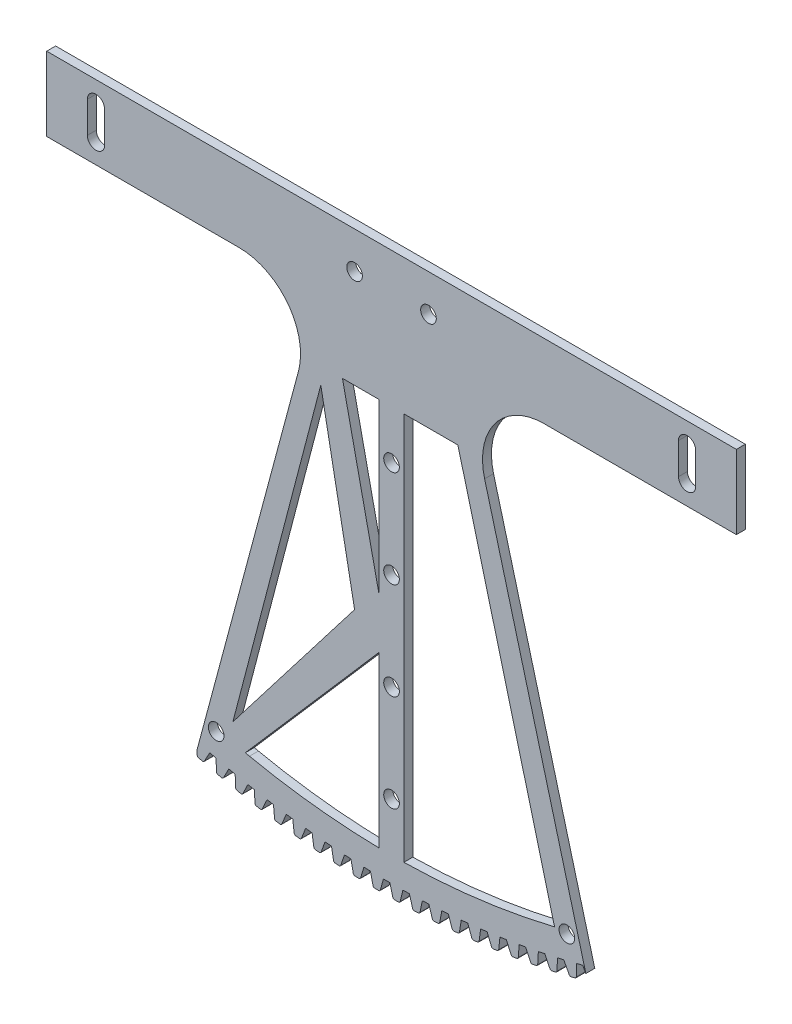
from build123d import *

# Parameters (mm, degrees)
BOSS_EXTRUDE2_DEPTH      = 3.628571429
FILLET1_R                = 25
BOSS_EXTRUDE4_DEPTH      = 3.628571429
CUT_EXTRUDE2_DEPTH       = 336.434355024
FILLET2_R                = 0.7
CIRPATTERN8_COUNT        = 20
CIRPATTERN8_ANGLE        = 28.5
FILLET2_OF_CIRPATTERN8_R = 0.7
SKETCH5_R                = 3.175
CUT_EXTRUDE3_DEPTH       = 338.740173511
SKETCH17_R               = 3.175
CUT_EXTRUDE4_DEPTH       = 338.740173511


with BuildPart() as part:
    # Sketch3 → Boss-Extrude2 (new body)
    with BuildSketch(Plane.XY):
        with BuildLine():
            Line((-140, -79.56), (-140, -109.56))
            Line((-140, -109.56), (-29.356513523, -109.56))
            Line((-29.356513523, -109.56), (-78.888044947, -294.414191853))
            ThreePointArc((-78.888044947, -294.414191853), (0, -304.8), (78.888044947, -294.414191853))
            Line((78.888044947, -294.414191853), (29.356513523, -109.56))
            Line((29.356513523, -109.56), (140, -109.56))
            Line((140, -109.56), (140, -79.56))
            Line((140, -79.56), (-140, -79.56))
        make_face()
    extrude(amount=BOSS_EXTRUDE2_DEPTH)

    # Fillet1
    fillet1_edges = [part.edges().sort_by_distance(p)[0] for p in [
        (29.356513523, -109.56, 1.814285714),
        (-29.356513523, -109.56, 1.814285714),
    ]]
    fillet(fillet1_edges, radius=FILLET1_R)

    # Sketch14 → Boss-Extrude4 (add)
    with BuildSketch(Plane(origin=(0, 0, 0), x_dir=(-1, 0, 0), z_dir=(0, 0, -1))):
        with BuildLine():
            Line((78.910933272, -297.036934084), (78.888044947, -294.414191853))
            ThreePointArc((78.888044947, -294.414191853), (76.959432674, -294.924203351), (75.027523715, -295.421581279))
            Line((75.027523715, -295.421581279), (76.289081309, -297.721097125))
            Line((76.289081309, -297.721097125), (78.910933272, -297.036934084))
        make_face()
    boss_extrude4 = extrude(amount=-BOSS_EXTRUDE4_DEPTH)

    # Sketch16 → Cut-Extrude2 (cut, symmetric)
    with BuildSketch(Plane(origin=(0, 0, 0), x_dir=(-1, 0, 0), z_dir=(0, 0, -1))):
        Polygon((372.937709596, -838.440145613), (75.027523715, -295.421581279), (73.765262731, -293.12078332), (71.19993834, -293.754449124), (71.154137831, -296.378353915), (60.344615656, -915.654378233), (357.400151379, -2118.250141136), (669.993245319, -2041.035908516), align=None)
    cut_extrude2 = extrude(amount=CUT_EXTRUDE2_DEPTH, both=True, mode=Mode.SUBTRACT)

    # Fillet2
    fillet2_edges = [part.edges().sort_by_distance(p)[0] for p in [
        (-76.289081309, -297.721097125, 1.814285714),
        (-78.910933272, -297.036934084, 1.814285714),
    ]]
    fillet(fillet2_edges, radius=FILLET2_R)

    # CirPattern8: Boss-Extrude4, Cut-Extrude2 ×20 about axis
    cirpattern8_axis = Axis((0, 0, 0), (0, 0, 1))
    add([boss_extrude4.rotate(cirpattern8_axis, i * CIRPATTERN8_ANGLE / (CIRPATTERN8_COUNT - 1)) for i in range(1, CIRPATTERN8_COUNT)])
    add([cut_extrude2.rotate(cirpattern8_axis, i * CIRPATTERN8_ANGLE / (CIRPATTERN8_COUNT - 1)) for i in range(1, CIRPATTERN8_COUNT)], mode=Mode.SUBTRACT)

    # Fillet2 of CirPattern8
    fillet2_of_cirpattern8_edges = [part.edges().sort_by_distance(p)[0] for p in [
        (-68.469509176, -299.616090878, 1.814285714),
        (-71.108371997, -299.000794367, 1.814285714),
        (-60.603011462, -301.305742729, 1.814285714),
        (-63.257076596, -300.75973444, 1.814285714),
        (-52.694979472, -302.788894675, 1.814285714),
        (-55.362427954, -302.312548815, 1.814285714),
        (-44.750832974, -304.064530237, 1.814285714),
        (-47.429836669, -303.65817327, 1.814285714),
        (-36.776016491, -305.131775158, 1.814285714),
        (-39.464739344, -304.795685581, 1.814285714),
        (-28.775995563, -305.989898002, 1.814285714),
        (-31.472594858, -305.724306153, 1.814285714),
        (-20.756253006, -306.638310655, 1.814285714),
        (-23.458880627, -306.443398558, 1.814285714),
        (-12.722285149, -307.076568726, 1.814285714),
        (-15.429088851, -306.952469964, 1.814285714),
        (-4.679598073, -307.304371856, 1.814285714),
        (-7.388722748, -307.251171481, 1.814285714),
        (3.366296165, -307.32156392, 1.814285714),
        (0.656707216, -307.339298391, 1.814285714),
        (11.409883312, -307.128133135, 1.814285714),
        (8.701687106, -307.216790299, 1.814285714),
        (19.445650695, -306.724212069, 1.814285714),
        (16.740703294, -306.883731164, 1.814285714),
        (27.468091, -306.110077549, 1.814285714),
        (24.76824624, -306.340349249, 1.814285714),
        (35.471706048, -305.286150472, 1.814285714),
        (32.778814268, -305.587016961, 1.814285714),
        (43.45101056, -304.252995517, 1.814285714),
        (40.766917333, -304.624250596, 1.814285714),
        (51.40053592, -303.011320757, 1.814285714),
        (48.72708079, -303.452709986, 1.814285714),
        (59.31483392, -301.561977174, 1.814285714),
        (56.65384914, -302.073198046, 1.814285714),
        (67.188480496, -299.905958075, 1.814285714),
        (64.541789771, -300.486660225, 1.814285714),
        (75.016079444, -298.044398412, 1.814285714),
        (72.385496683, -298.694183857, 1.814285714),
    ]]
    fillet(fillet2_of_cirpattern8_edges, radius=FILLET2_OF_CIRPATTERN8_R)

    # Sketch5 → Cut-Extrude3 (cut, through all)
    with BuildSketch(Plane(origin=(0, 0, 0), x_dir=(-1, 0, 0), z_dir=(0, 0, -1))):
        with Locations((-15, -94.56)):
            Circle(SKETCH5_R)
        with Locations((15, -94.56)):
            Circle(SKETCH5_R)
        with BuildLine():
            Line((-123.5, -94.56), (-123.5, -100.91))
            ThreePointArc((-123.5, -100.91), (-120, -104.41), (-116.5, -100.91))
            Line((-116.5, -100.91), (-116.5, -94.56))
            Line((-116.5, -94.56), (-116.5, -88.21))
            ThreePointArc((-116.5, -88.21), (-120, -84.71), (-123.5, -88.21))
            Line((-123.5, -88.21), (-123.5, -94.56))
        make_face()
        with BuildLine():
            Line((116.5, -94.56), (116.5, -88.21))
            ThreePointArc((116.5, -88.21), (120, -84.71), (123.5, -88.21))
            Line((123.5, -88.21), (123.5, -94.56))
            Line((123.5, -94.56), (123.5, -100.91))
            ThreePointArc((123.5, -100.91), (120, -104.41), (116.5, -100.91))
            Line((116.5, -100.91), (116.5, -94.56))
        make_face()
    extrude(amount=-CUT_EXTRUDE3_DEPTH, mode=Mode.SUBTRACT)

    # Sketch17 → Cut-Extrude4 (cut, through all)
    with BuildSketch(Plane(origin=(0, 0, 0), x_dir=(-1, 0, 0), z_dir=(0, 0, -1))):
        with BuildLine():
            Line((-64.419853025, -277.589898046), (-66.194365296, -284.361242536))
            ThreePointArc((-66.194365296, -284.361242536), (-62.788540566, -285.167987316), (-59.372890863, -285.932066063))
            ThreePointArc((-59.372890863, -285.932066063), (-60.205150935, -280.737803377), (-64.419853025, -277.589898046))
        make_face()
        Polygon((15, -213.409642912), (64.419853025, -277.589898046), (28.711660115, -141.33134449), align=None)
        with BuildLine():
            Line((57.677925946, -286.294618468), (59.356743472, -285.913498464))
            Line((59.356743472, -285.913498464), (5, -223.409642912))
            Line((5, -223.409642912), (5, -292.259285824))
            ThreePointArc((5, -292.259285824), (31.480548191, -290.527384931), (57.677925946, -286.294618468))
        make_face()
        with BuildLine():
            Line((-26.937147844, -134.56), (-64.419853025, -277.589898046))
            ThreePointArc((-64.419853025, -277.589898046), (-60.205150935, -280.737803377), (-59.372890863, -285.932066063))
            ThreePointArc((-59.372890863, -285.932066063), (-32.341547535, -290.428544105), (-5, -292.259285824))
            Line((-5, -292.259285824), (-5, -134.56))
            Line((-5, -134.56), (-26.937147844, -134.56))
        make_face()
        Polygon((5, -203.409642912), (19.937147844, -134.56), (5, -134.56), align=None)
        with Locations((0, -193.697232184)):
            Circle(SKETCH17_R)
        with Locations((0, -154.272410728)):
            Circle(SKETCH17_R)
        with Locations((0, -233.12205364)):
            Circle(SKETCH17_R)
        with Locations((0, -272.546875096)):
            Circle(SKETCH17_R)
        with Locations((71.194365296, -284.361242536)):
            Circle(SKETCH17_R)
        with Locations((-71.194365296, -284.361242536)):
            Circle(SKETCH17_R)
    extrude(amount=-CUT_EXTRUDE4_DEPTH, mode=Mode.SUBTRACT)


solid = part.part
